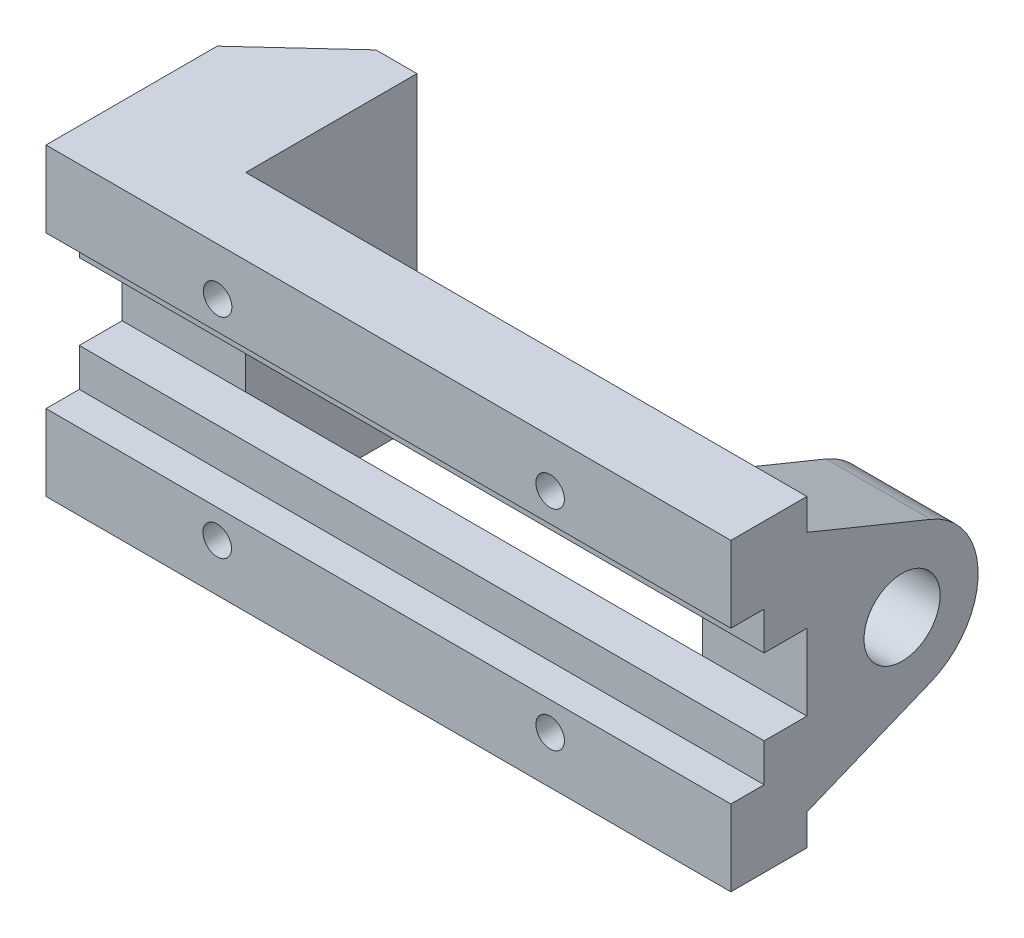
from build123d import *

# Parameters (mm, degrees)
BOSS_EXTRUDE2_DEPTH     = 64
SKETCH8_R               = 8
BOSS_EXTRUDE3_DEPTH     = 22
CUT_EXTRUDE1_DEPTH      = 162.641578809
CUT_EXTRUDE1_DEPTH_BACK = 162.641578809
SKETCH9_R               = 3
CUT_EXTRUDE2_DEPTH      = 11


with BuildPart() as part:
    # Sketch3 → Boss-Extrude2 (new body)
    with BuildSketch(Plane(origin=(0, 0, 0), x_dir=(1, 0, 0), z_dir=(0, 1, 0))):
        Polygon((26, 36), (26, 0), (144, 0), (144, -16), (0, -16), (0, 0), (0, 20), (17.362220716, 36), align=None)
    extrude(amount=BOSS_EXTRUDE2_DEPTH)

    # Sketch8 → Boss-Extrude3 (add)
    with BuildSketch(Plane(origin=(144, 0, 0), x_dir=(0, 0, -1), z_dir=(1, 0, 0))):
        with BuildLine():
            Line((26.053796804, 46.810521404), (-16, 64))
            Line((-16, 64), (-16, 48))
            Line((-16, 48), (-9, 48))
            Line((-9, 48), (-9, 40))
            Line((-9, 40), (0, 40))
            Line((0, 40), (0, 24))
            Line((0, 24), (-9, 24))
            Line((-9, 24), (-9, 16))
            Line((-9, 16), (-16, 16))
            Line((-16, 16), (-16, 0))
            Line((-16, 0), (26.053796804, 17.189478596))
            ThreePointArc((26.053796804, 17.189478596), (36, 32), (26.053796804, 46.810521404))
        make_face()
        with Locations((20, 32)):
            Circle(SKETCH8_R, mode=Mode.SUBTRACT)
    extrude(amount=-BOSS_EXTRUDE3_DEPTH)

    # Sketch8<6> → Cut-Extrude1 (cut, two sides: drawn at the far end of the back side and taken through both)
    with BuildSketch(Plane(origin=(144, 0, 0), x_dir=(0, 0, -1), z_dir=(1, 0, 0)).offset(-CUT_EXTRUDE1_DEPTH_BACK)):
        Polygon((0, 40), (-9, 40), (-9, 48), (-16, 48), (-16, 16), (-9, 16), (-9, 24), (0, 24), align=None)
    extrude(amount=CUT_EXTRUDE1_DEPTH + CUT_EXTRUDE1_DEPTH_BACK, mode=Mode.SUBTRACT)

    # Sketch9 → Cut-Extrude2 (cut)
    with BuildSketch(Plane.XY.offset(16)):
        with Locations((106, 54)):
            Circle(SKETCH9_R)
        with Locations((106, 10)):
            Circle(SKETCH9_R)
        with Locations((36.080551107, 54)):
            Circle(SKETCH9_R)
        with Locations((36, 10)):
            Circle(SKETCH9_R)
    extrude(amount=-CUT_EXTRUDE2_DEPTH, mode=Mode.SUBTRACT)


solid = part.part
